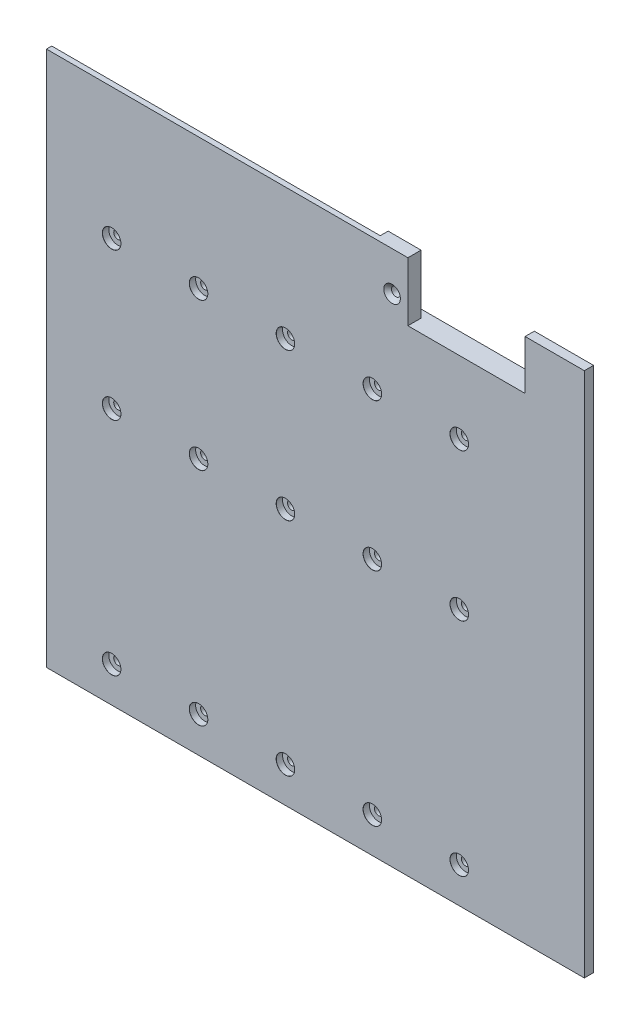
from build123d import *

# Parameters (mm, degrees)
ESQUISSE1_W                                    = 408.5
ESQUISSE1_H                                    = 181
BOSS_EXTRU_1_DEPTH                             = 8
CHAMBRAGE_POUR_VIS_T_TE_RONDE_BOMB_2_COUNT     = 2
CHAMBRAGE_POUR_VIS_T_TE_RONDE_BOMB_2_PITCH     = 56
CHAMBRAGE_POUR_VIS_T_TE_RONDE_BOMB_3_COUNT     = 2
CHAMBRAGE_POUR_VIS_T_TE_RONDE_BOMB_3_PITCH     = 140
R_P_TITION_LIN_AIRE1_COUNT                     = 11
R_P_TITION_LIN_AIRE1_PITCH                     = 33
ENL_V_MAT_EXTRU_1_REACH                        = 275.026
ESQUISSE6_W                                    = 22.5
ESQUISSE6_H                                    = 4.5
BOSS_EXTRU_2_START                             = -3.5
ESQUISSE7_W                                    = 22.5
ESQUISSE7_H                                    = 18.725
BOSS_EXTRU_2_DEPTH                             = 3.5
ESQUISSE8_W                                    = 274.5
ESQUISSE8_H                                    = 22.375
BOSS_EXTRU_3_DEPTH                             = 5
FRAISAGE_POUR_VIS_T_TE_FRAIS_E_M31_D           = 3.4
FRAISAGE_POUR_VIS_T_TE_FRAIS_E_M31_CSINK_D     = 6.3
FRAISAGE_POUR_VIS_T_TE_FRAIS_E_M31_CSINK_ANGLE = 90
ESQUISSE12_W                                   = 249.5
ESQUISSE12_H                                   = 22.375
ENL_V_MAT_EXTRU_2_DEPTH                        = 3
ESQUISSE13_W                                   = 204.25
ESQUISSE13_H                                   = 203.375
ENL_V_MAT_EXTRU_3_DEPTH                        = 10


with BuildPart() as part:
    # Esquisse1 → Boss.-Extru.1 (new body)
    with BuildSketch(Plane.XY):
        Rectangle(ESQUISSE1_W, ESQUISSE1_H)
    extrude(amount=BOSS_EXTRU_1_DEPTH)

    # Esquisse3 → Chambrage pour vis à tête ronde bombée M31 (revolve, cut)
    with BuildSketch(Plane(origin=(-173.25, 63, 8), x_dir=(0, -1, 0), z_dir=(1, 0, 0))):
        Polygon((0, 0), (0, 8), (1.6, 8), (1.6, 2.4), (3.5, 2.4), (3.5, 0.025), (3.525, 0), align=None)
    chambrage_pour_vis_t_te_ronde_bomb_e_m = revolve(axis=Axis((-173.25, 63, 14.35), (0, 0, -1)), mode=Mode.SUBTRACT)

    # Chambrage pour vis _ t_te ronde bomb 2: Chambrage pour vis à tête ronde bombée M31 ×2
    with Locations(*[(0, -i * CHAMBRAGE_POUR_VIS_T_TE_RONDE_BOMB_2_PITCH, 0) for i in range(1, CHAMBRAGE_POUR_VIS_T_TE_RONDE_BOMB_2_COUNT)]):
        add(chambrage_pour_vis_t_te_ronde_bomb_e_m, mode=Mode.SUBTRACT)

    # Chambrage pour vis _ t_te ronde bomb 3: Chambrage pour vis à tête ronde bombée M31 ×2
    with Locations(*[(0, -i * CHAMBRAGE_POUR_VIS_T_TE_RONDE_BOMB_3_PITCH, 0) for i in range(1, CHAMBRAGE_POUR_VIS_T_TE_RONDE_BOMB_3_COUNT)]):
        add(chambrage_pour_vis_t_te_ronde_bomb_e_m, mode=Mode.SUBTRACT)

    # Répétition linéaire1: Chambrage pour vis à tête ronde bombée M31 ×11
    with Locations(*[(i * R_P_TITION_LIN_AIRE1_PITCH, 0, 0) for i in range(1, R_P_TITION_LIN_AIRE1_COUNT)]):
        add(chambrage_pour_vis_t_te_ronde_bomb_e_m, mode=Mode.SUBTRACT)

    # Répétition linéaire1 copy 1 sketch → Répétition linéaire1 copy 1 (revolve, cut)
    with BuildSketch(Plane(origin=(-140.25, 7, 8), x_dir=(0, -1, 0), z_dir=(1, 0, 0))):
        Polygon((0, 0), (0, 8), (1.6, 8), (1.6, 2.4), (3.5, 2.4), (3.5, 0.025), (3.525, 0), align=None)
    revolve(axis=Axis((-140.25, 7, 14.35), (0, 0, -1)), mode=Mode.SUBTRACT)

    # Répétition linéaire1 copy 2 sketch → Répétition linéaire1 copy 2 (revolve, cut)
    with BuildSketch(Plane(origin=(-107.25, 7, 8), x_dir=(0, -1, 0), z_dir=(1, 0, 0))):
        Polygon((0, 0), (0, 8), (1.6, 8), (1.6, 2.4), (3.5, 2.4), (3.5, 0.025), (3.525, 0), align=None)
    revolve(axis=Axis((-107.25, 7, 14.35), (0, 0, -1)), mode=Mode.SUBTRACT)

    # Répétition linéaire1 copy 3 sketch → Répétition linéaire1 copy 3 (revolve, cut)
    with BuildSketch(Plane(origin=(-74.25, 7, 8), x_dir=(0, -1, 0), z_dir=(1, 0, 0))):
        Polygon((0, 0), (0, 8), (1.6, 8), (1.6, 2.4), (3.5, 2.4), (3.5, 0.025), (3.525, 0), align=None)
    revolve(axis=Axis((-74.25, 7, 14.35), (0, 0, -1)), mode=Mode.SUBTRACT)

    # Répétition linéaire1 copy 4 sketch → Répétition linéaire1 copy 4 (revolve, cut)
    with BuildSketch(Plane(origin=(-41.25, 7, 8), x_dir=(0, -1, 0), z_dir=(1, 0, 0))):
        Polygon((0, 0), (0, 8), (1.6, 8), (1.6, 2.4), (3.5, 2.4), (3.5, 0.025), (3.525, 0), align=None)
    revolve(axis=Axis((-41.25, 7, 14.35), (0, 0, -1)), mode=Mode.SUBTRACT)

    # Répétition linéaire1 copy 5 sketch → Répétition linéaire1 copy 5 (revolve, cut)
    with BuildSketch(Plane(origin=(-8.25, 7, 8), x_dir=(0, -1, 0), z_dir=(1, 0, 0))):
        Polygon((0, 0), (0, 8), (1.6, 8), (1.6, 2.4), (3.5, 2.4), (3.5, 0.025), (3.525, 0), align=None)
    revolve(axis=Axis((-8.25, 7, 14.35), (0, 0, -1)), mode=Mode.SUBTRACT)

    # Répétition linéaire1 copy 6 sketch → Répétition linéaire1 copy 6 (revolve, cut)
    with BuildSketch(Plane(origin=(24.75, 7, 8), x_dir=(0, -1, 0), z_dir=(1, 0, 0))):
        Polygon((0, 0), (0, 8), (1.6, 8), (1.6, 2.4), (3.5, 2.4), (3.5, 0.025), (3.525, 0), align=None)
    revolve(axis=Axis((24.75, 7, 14.35), (0, 0, -1)), mode=Mode.SUBTRACT)

    # Répétition linéaire1 copy 7 sketch → Répétition linéaire1 copy 7 (revolve, cut)
    with BuildSketch(Plane(origin=(57.75, 7, 8), x_dir=(0, -1, 0), z_dir=(1, 0, 0))):
        Polygon((0, 0), (0, 8), (1.6, 8), (1.6, 2.4), (3.5, 2.4), (3.5, 0.025), (3.525, 0), align=None)
    revolve(axis=Axis((57.75, 7, 14.35), (0, 0, -1)), mode=Mode.SUBTRACT)

    # Répétition linéaire1 copy 8 sketch → Répétition linéaire1 copy 8 (revolve, cut)
    with BuildSketch(Plane(origin=(90.75, 7, 8), x_dir=(0, -1, 0), z_dir=(1, 0, 0))):
        Polygon((0, 0), (0, 8), (1.6, 8), (1.6, 2.4), (3.5, 2.4), (3.5, 0.025), (3.525, 0), align=None)
    revolve(axis=Axis((90.75, 7, 14.35), (0, 0, -1)), mode=Mode.SUBTRACT)

    # Répétition linéaire1 copy 9 sketch → Répétition linéaire1 copy 9 (revolve, cut)
    with BuildSketch(Plane(origin=(123.75, 7, 8), x_dir=(0, -1, 0), z_dir=(1, 0, 0))):
        Polygon((0, 0), (0, 8), (1.6, 8), (1.6, 2.4), (3.5, 2.4), (3.5, 0.025), (3.525, 0), align=None)
    revolve(axis=Axis((123.75, 7, 14.35), (0, 0, -1)), mode=Mode.SUBTRACT)

    # Répétition linéaire1 copy 10 sketch → Répétition linéaire1 copy 10 (revolve, cut)
    with BuildSketch(Plane(origin=(156.75, 7, 8), x_dir=(0, -1, 0), z_dir=(1, 0, 0))):
        Polygon((0, 0), (0, 8), (1.6, 8), (1.6, 2.4), (3.5, 2.4), (3.5, 0.025), (3.525, 0), align=None)
    revolve(axis=Axis((156.75, 7, 14.35), (0, 0, -1)), mode=Mode.SUBTRACT)

    # Répétition linéaire1 copy 11 sketch → Répétition linéaire1 copy 11 (revolve, cut)
    with BuildSketch(Plane(origin=(-140.25, -77, 8), x_dir=(0, -1, 0), z_dir=(1, 0, 0))):
        Polygon((0, 0), (0, 8), (1.6, 8), (1.6, 2.4), (3.5, 2.4), (3.5, 0.025), (3.525, 0), align=None)
    revolve(axis=Axis((-140.25, -77, 14.35), (0, 0, -1)), mode=Mode.SUBTRACT)

    # Répétition linéaire1 copy 12 sketch → Répétition linéaire1 copy 12 (revolve, cut)
    with BuildSketch(Plane(origin=(-107.25, -77, 8), x_dir=(0, -1, 0), z_dir=(1, 0, 0))):
        Polygon((0, 0), (0, 8), (1.6, 8), (1.6, 2.4), (3.5, 2.4), (3.5, 0.025), (3.525, 0), align=None)
    revolve(axis=Axis((-107.25, -77, 14.35), (0, 0, -1)), mode=Mode.SUBTRACT)

    # Répétition linéaire1 copy 13 sketch → Répétition linéaire1 copy 13 (revolve, cut)
    with BuildSketch(Plane(origin=(-74.25, -77, 8), x_dir=(0, -1, 0), z_dir=(1, 0, 0))):
        Polygon((0, 0), (0, 8), (1.6, 8), (1.6, 2.4), (3.5, 2.4), (3.5, 0.025), (3.525, 0), align=None)
    revolve(axis=Axis((-74.25, -77, 14.35), (0, 0, -1)), mode=Mode.SUBTRACT)

    # Répétition linéaire1 copy 14 sketch → Répétition linéaire1 copy 14 (revolve, cut)
    with BuildSketch(Plane(origin=(-41.25, -77, 8), x_dir=(0, -1, 0), z_dir=(1, 0, 0))):
        Polygon((0, 0), (0, 8), (1.6, 8), (1.6, 2.4), (3.5, 2.4), (3.5, 0.025), (3.525, 0), align=None)
    revolve(axis=Axis((-41.25, -77, 14.35), (0, 0, -1)), mode=Mode.SUBTRACT)

    # Répétition linéaire1 copy 15 sketch → Répétition linéaire1 copy 15 (revolve, cut)
    with BuildSketch(Plane(origin=(-8.25, -77, 8), x_dir=(0, -1, 0), z_dir=(1, 0, 0))):
        Polygon((0, 0), (0, 8), (1.6, 8), (1.6, 2.4), (3.5, 2.4), (3.5, 0.025), (3.525, 0), align=None)
    revolve(axis=Axis((-8.25, -77, 14.35), (0, 0, -1)), mode=Mode.SUBTRACT)

    # Répétition linéaire1 copy 16 sketch → Répétition linéaire1 copy 16 (revolve, cut)
    with BuildSketch(Plane(origin=(24.75, -77, 8), x_dir=(0, -1, 0), z_dir=(1, 0, 0))):
        Polygon((0, 0), (0, 8), (1.6, 8), (1.6, 2.4), (3.5, 2.4), (3.5, 0.025), (3.525, 0), align=None)
    revolve(axis=Axis((24.75, -77, 14.35), (0, 0, -1)), mode=Mode.SUBTRACT)

    # Répétition linéaire1 copy 17 sketch → Répétition linéaire1 copy 17 (revolve, cut)
    with BuildSketch(Plane(origin=(57.75, -77, 8), x_dir=(0, -1, 0), z_dir=(1, 0, 0))):
        Polygon((0, 0), (0, 8), (1.6, 8), (1.6, 2.4), (3.5, 2.4), (3.5, 0.025), (3.525, 0), align=None)
    revolve(axis=Axis((57.75, -77, 14.35), (0, 0, -1)), mode=Mode.SUBTRACT)

    # Répétition linéaire1 copy 18 sketch → Répétition linéaire1 copy 18 (revolve, cut)
    with BuildSketch(Plane(origin=(90.75, -77, 8), x_dir=(0, -1, 0), z_dir=(1, 0, 0))):
        Polygon((0, 0), (0, 8), (1.6, 8), (1.6, 2.4), (3.5, 2.4), (3.5, 0.025), (3.525, 0), align=None)
    revolve(axis=Axis((90.75, -77, 14.35), (0, 0, -1)), mode=Mode.SUBTRACT)

    # Répétition linéaire1 copy 19 sketch → Répétition linéaire1 copy 19 (revolve, cut)
    with BuildSketch(Plane(origin=(123.75, -77, 8), x_dir=(0, -1, 0), z_dir=(1, 0, 0))):
        Polygon((0, 0), (0, 8), (1.6, 8), (1.6, 2.4), (3.5, 2.4), (3.5, 0.025), (3.525, 0), align=None)
    revolve(axis=Axis((123.75, -77, 14.35), (0, 0, -1)), mode=Mode.SUBTRACT)

    # Répétition linéaire1 copy 20 sketch → Répétition linéaire1 copy 20 (revolve, cut)
    with BuildSketch(Plane(origin=(156.75, -77, 8), x_dir=(0, -1, 0), z_dir=(1, 0, 0))):
        Polygon((0, 0), (0, 8), (1.6, 8), (1.6, 2.4), (3.5, 2.4), (3.5, 0.025), (3.525, 0), align=None)
    revolve(axis=Axis((156.75, -77, 14.35), (0, 0, -1)), mode=Mode.SUBTRACT)

    # Esquisse6 → Enlèv. mat.-Extru.1 (cut, up to next)
    with BuildSketch(Plane(origin=(0, 90.5, 0), x_dir=(1, 0, 0), z_dir=(0, 1, 0)), mode=Mode.PRIVATE) as enl_v_mat_extru_1_sk1:
        with Locations((-193, -2.25)):
            Rectangle(ESQUISSE6_W, ESQUISSE6_H)
    enl_v_mat_extru_1_tool1 = extrude(enl_v_mat_extru_1_sk1.sketch, amount=-ENL_V_MAT_EXTRU_1_REACH, mode=Mode.PRIVATE) & part.part
    # Esquisse6 → Enlèv. mat.-Extru.1 (cut, up to next)
    with BuildSketch(Plane(origin=(0, 90.5, 0), x_dir=(1, 0, 0), z_dir=(0, 1, 0)), mode=Mode.PRIVATE) as enl_v_mat_extru_1_sk2:
        with Locations((193, -2.25)):
            Rectangle(ESQUISSE6_W, ESQUISSE6_H)
    enl_v_mat_extru_1_tool2 = extrude(enl_v_mat_extru_1_sk2.sketch, amount=-ENL_V_MAT_EXTRU_1_REACH, mode=Mode.PRIVATE) & part.part
    add(enl_v_mat_extru_1_tool1.solids().sort_by_distance((-193, 90.5, 2.25))[0], mode=Mode.SUBTRACT)
    add(enl_v_mat_extru_1_tool2.solids().sort_by_distance((193, 90.5, 2.25))[0], mode=Mode.SUBTRACT)

    # Esquisse7 → Boss.-Extru.2 (add)
    with BuildSketch(Plane.XY.offset(8).offset(BOSS_EXTRU_2_START)):
        with Locations((-193, 99.8625)):
            Rectangle(ESQUISSE7_W, ESQUISSE7_H)
    boss_extru_2 = extrude(amount=BOSS_EXTRU_2_DEPTH)

    # Symétrie1: Boss.-Extru.2 across plane
    add(boss_extru_2.mirror(Plane(origin=(0, 0, 0), x_dir=(0, 0, 1), z_dir=(1, 0, 0))))

    # Esquisse8 → Boss.-Extru.3 (add)
    with BuildSketch(Plane.XY.offset(8)):
        with Locations((0, 101.6875)):
            Rectangle(ESQUISSE8_W, ESQUISSE8_H)
    extrude(amount=-BOSS_EXTRU_3_DEPTH)

    # Fraisage pour vis à tête fraisée M31 (through all)
    with Locations(Plane.XY.offset(8)):
        with Locations((-131.25, 98), (131.25, 98)):
            CounterSinkHole(FRAISAGE_POUR_VIS_T_TE_FRAIS_E_M31_D / 2, FRAISAGE_POUR_VIS_T_TE_FRAIS_E_M31_CSINK_D / 2, counter_sink_angle=FRAISAGE_POUR_VIS_T_TE_FRAIS_E_M31_CSINK_ANGLE)

    # Esquisse12 → Enlèv. mat.-Extru.2 (cut)
    with BuildSketch(Plane(origin=(0, 0, 3), x_dir=(-1, 0, 0), z_dir=(0, 0, -1))):
        with Locations((0, 101.6875)):
            Rectangle(ESQUISSE12_W, ESQUISSE12_H)
    extrude(amount=-ENL_V_MAT_EXTRU_2_DEPTH, mode=Mode.SUBTRACT)

    # Esquisse13 → Enlèv. mat.-Extru.3 (cut)
    with BuildSketch(Plane(origin=(0, 0, 0), x_dir=(-1, 0, 0), z_dir=(0, 0, -1))):
        with Locations((102.125, 11.1875)):
            Rectangle(ESQUISSE13_W, ESQUISSE13_H)
    extrude(amount=-ENL_V_MAT_EXTRU_3_DEPTH, mode=Mode.SUBTRACT)


solid = part.part
